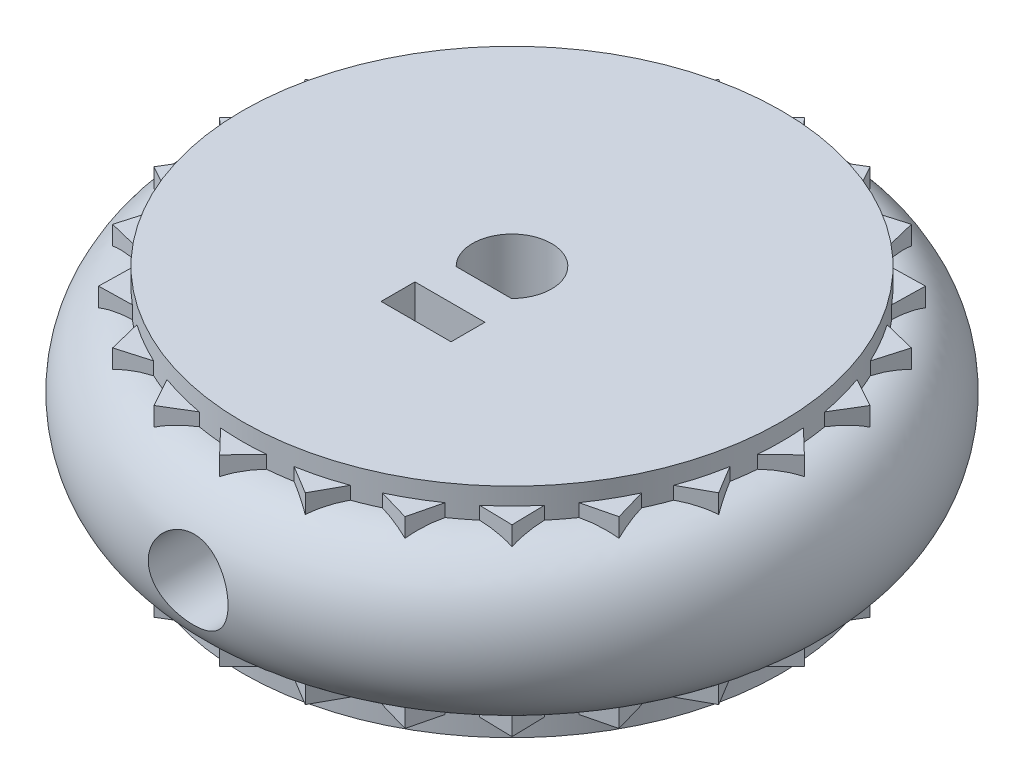
from build123d import *

# Parameters (mm, degrees)
SKETCH1_W           = 23.876
SKETCH1_H           = 19.304
SKETCH2_W           = 6.2
SKETCH2_H           = 3
CUT_EXTRUDE1_DEPTH  = 46.597068192
SKETCH3_R           = 2
CUT_EXTRUDE2_DEPTH  = 33.528
BOSS_EXTRUDE1_DEPTH = 16.256
SKETCH4_R           = 3.5
CUT_EXTRUDE3_DEPTH  = 22.86
CIRPATTERN1_COUNT   = 24


with BuildPart() as part:
    # Sketch1 → Revolve1 (revolve)
    with BuildSketch(Plane(origin=(0, 0, 0), x_dir=(0, 0, -1), z_dir=(1, 0, 0)), mode=Mode.PRIVATE) as revolve1_sk:
        with Locations((11.938, 9.652)):
            Rectangle(SKETCH1_W, SKETCH1_H)
        with BuildLine():
            Line((23.876, 9.652), (23.876, 2.667))
            add(Edge.make_bspline(
                [(23.876, 2.667), (29.21, 2.667), (29.21, 9.652)],
                knots=[0, 0, 0, 1.570796327, 1.570796327, 1.570796327], degree=2, weights=[1, 0.707106781, 1]))
            Line((29.21, 9.652), (23.876, 9.652))
        make_face()
        with BuildLine():
            Line((23.876, 16.637), (23.876, 9.652))
            Line((23.876, 9.652), (29.21, 9.652))
            add(Edge.make_bspline(
                [(29.21, 9.652), (29.21, 16.637), (23.876, 16.637)],
                knots=[1.570796327, 1.570796327, 1.570796327, 3.141592654, 3.141592654, 3.141592654], degree=2, weights=[1, 0.707106781, 1]))
        make_face()
    revolve(revolve1_sk.sketch.rotate(Axis((0, 19.304, 0), (0, -1, 0)), 180), axis=Axis((0, 19.304, 0), (0, -1, 0)))

    # Sketch2 → Cut-Extrude1 (cut, through all)
    with BuildSketch(Plane.XZ):
        with BuildLine():
            Line((-2.449489743, 2.5), (2.449489743, 2.5))
            ThreePointArc((2.449489743, 2.5), (0, -3.5), (-2.449489743, 2.5))
        make_face()
        with Locations((0, 7)):
            Rectangle(SKETCH2_W, SKETCH2_H)
    extrude(amount=-CUT_EXTRUDE1_DEPTH, mode=Mode.SUBTRACT)

    # Sketch3 → Cut-Extrude2 (cut)
    with BuildSketch(Plane(origin=(0, 0, 33.9), x_dir=(-1, 0, 0), z_dir=(0, 0, -1))):
        with Locations(Location((-0.3, 9.652, 0), (0, 0, 180))):
            Circle(SKETCH3_R)
    extrude(amount=CUT_EXTRUDE2_DEPTH, mode=Mode.SUBTRACT)

    # Sketch5 → Boss-Extrude1 (add)
    with BuildSketch(Plane(origin=(0, 17.78, 0), x_dir=(1, 0, 0), z_dir=(0, 1, 0))):
        with BuildLine():
            ThreePointArc((2.032, -23.789374771), (1.016922801, -23.854333862), (0, -23.876))
            Line((0, -23.876), (0, -25.908))
            Line((0, -25.908), (2.032, -23.789374771))
        make_face()
        with BuildLine():
            Line((0, -25.908), (0, -23.876))
            ThreePointArc((0, -23.876), (-1.016922801, -23.854333862), (-2.032, -23.789374771))
            Line((-2.032, -23.789374771), (0, -25.908))
        make_face()
    boss_extrude1 = extrude(amount=-BOSS_EXTRUDE1_DEPTH)

    # Sketch4 → Cut-Extrude3 (cut)
    with BuildSketch(Plane(origin=(0, 0, 33.9), x_dir=(-1, 0, 0), z_dir=(0, 0, -1))):
        with Locations(Location((-0.3, 9.652, 0), (0, 0, 180))):
            Circle(SKETCH4_R)
    extrude(amount=CUT_EXTRUDE3_DEPTH, mode=Mode.SUBTRACT)

    # CirPattern1: Boss-Extrude1 ×24 about axis
    cirpattern1_axis = Axis((0, 0, 0), (0, 1, 0))
    for i in range(1, CIRPATTERN1_COUNT):
        add(boss_extrude1.rotate(cirpattern1_axis, i * 360 / CIRPATTERN1_COUNT))


solid = part.part
